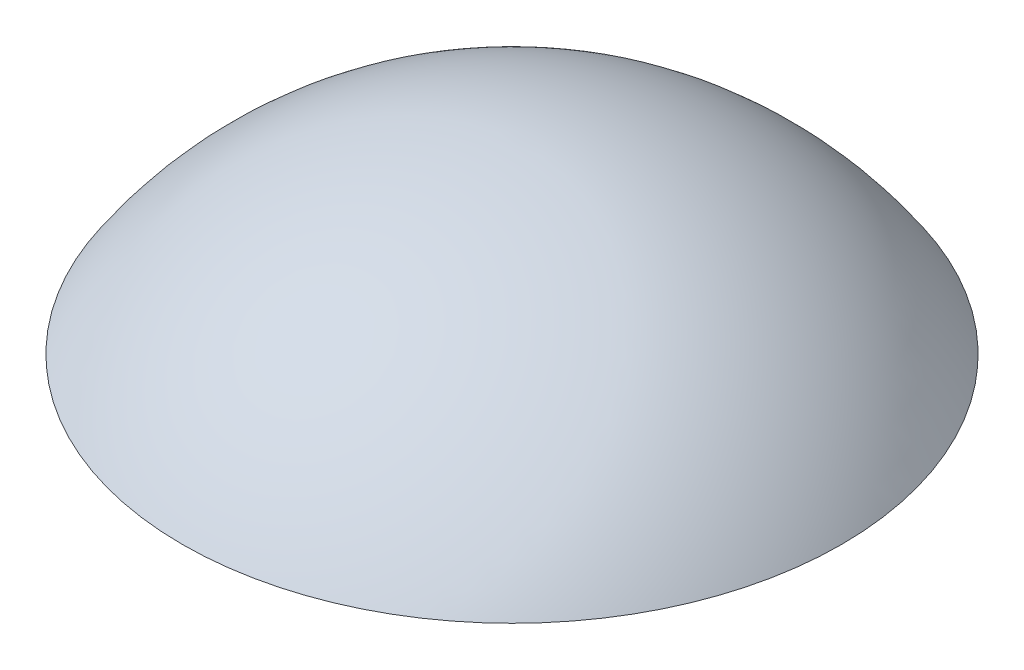
from build123d import *


with BuildPart() as part:
    # Sketch6 → Revolve1 (revolve)
    with BuildSketch(Plane.XY):
        with BuildLine():
            ThreePointArc((5.548153632, 4.336060606), (3.140413503, 6.498429102), (0, 7.28))
            Line((0, 7.28), (0, 7.8))
            ThreePointArc((0, 7.8), (3.705131577, 6.863818179), (6.520858839, 4.28))
            add(Edge.make_bspline(
                [(5.548153632, 4.336060606), (5.40298249, 5.044933477), (6.051343216, 4.92625791), (6.520858839, 4.28)],
                knots=[0, 0, 0, 0, 1, 1, 1, 1], degree=3))
        make_face()
    revolve(axis=Axis((0, 60.244207804, 0), (0, -1, 0)))


solid = part.part
